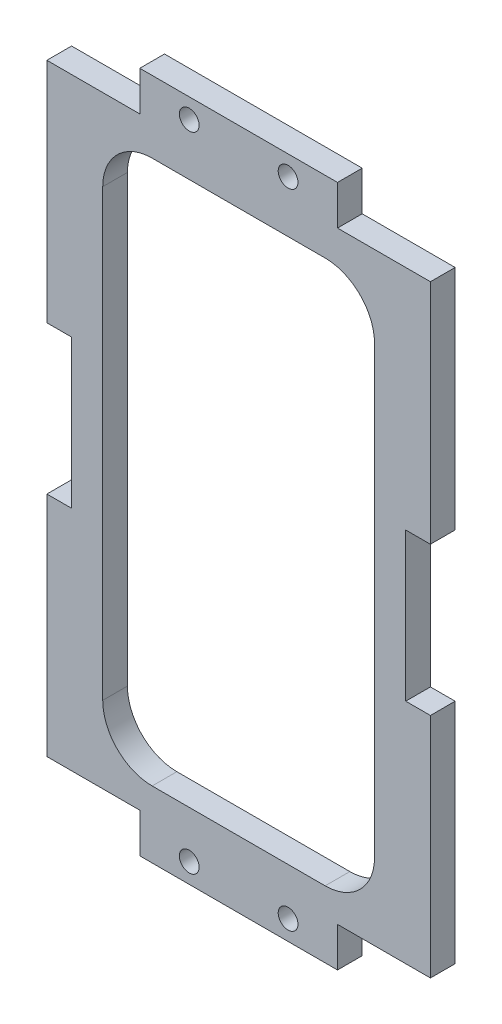
from build123d import *

# Parameters (mm, degrees)
SKETCH_1_W          = 77.6
SKETCH_1_H          = 137
EXTRUDE_1_DEPTH     = 5
SKETCH_3_W          = 18.8
SKETCH_3_H          = 7.5
SKETCH_3_W_2        = 5
SKETCH_3_H_2        = 30
CUT_EXTRUDE_1_DEPTH = 5
SKETCH_4_R          = 2
CUT_EXTRUDE_2_DEPTH = 5
SKETCH_5_W          = 55
SKETCH_5_H          = 110
CUT_EXTRUDE_3_DEPTH = 7
FILLET_1_R          = 10
SKETCH_7_W          = 40
SKETCH_7_H          = 0.5
EXTRUDE_2_DEPTH     = 5


with BuildPart() as part:
    # 草图1 → 凸台-拉伸1 (new body)
    with BuildSketch(Plane.XY):
        with Locations((38.8, 68.5)):
            Rectangle(SKETCH_1_W, SKETCH_1_H)
    extrude(amount=EXTRUDE_1_DEPTH)

    # 草图3 → 切除-拉伸1 (cut)
    with BuildSketch(Plane.XY.offset(5)):
        with Locations((9.4, 133.25)):
            Rectangle(SKETCH_3_W, SKETCH_3_H)
        with Locations((9.4, 3.75)):
            Rectangle(SKETCH_3_W, SKETCH_3_H)
        with Locations((68.2, 3.75)):
            Rectangle(SKETCH_3_W, SKETCH_3_H)
        with Locations((68.2, 133.25)):
            Rectangle(SKETCH_3_W, SKETCH_3_H)
        with Locations((75.1, 68.5)):
            Rectangle(SKETCH_3_W_2, SKETCH_3_H_2)
        with Locations((2.5, 68.5)):
            Rectangle(SKETCH_3_W_2, SKETCH_3_H_2)
    extrude(amount=-CUT_EXTRUDE_1_DEPTH, mode=Mode.SUBTRACT)

    # 草图4 → 切除-拉伸2 (cut)
    with BuildSketch(Plane.XY.offset(5)):
        with Locations((28.8, 133.5)):
            Circle(SKETCH_4_R)
        with Locations((48.8, 133.5)):
            Circle(SKETCH_4_R)
        with Locations((28.8, 3.5)):
            Circle(SKETCH_4_R)
        with Locations((48.8, 3.5)):
            Circle(SKETCH_4_R)
    extrude(amount=-CUT_EXTRUDE_2_DEPTH, mode=Mode.SUBTRACT)

    # 草图5 → 切除-拉伸3 (cut)
    with BuildSketch(Plane(origin=(0, 0, 0), x_dir=(-1, 0, 0), z_dir=(0, 0, -1))):
        with Locations((-38.8, 68)):
            Rectangle(SKETCH_5_W, SKETCH_5_H)
    extrude(amount=-CUT_EXTRUDE_3_DEPTH, mode=Mode.SUBTRACT)

    # 圆角1
    fillet_1_edges = [part.edges().sort_by_distance(p)[0] for p in [
        (66.3, 13, 2.5),
        (66.3, 123, 2.5),
        (11.3, 123, 2.5),
        (11.3, 13, 2.5),
    ]]
    fillet(fillet_1_edges, radius=FILLET_1_R)

    # 草图7 → 凸台-拉伸2 (add)
    with BuildSketch(Plane.XY.offset(5)):
        with Locations((38.8, 137.25)):
            Rectangle(SKETCH_7_W, SKETCH_7_H)
        with Locations((38.8, -0.25)):
            Rectangle(SKETCH_7_W, SKETCH_7_H)
    extrude(amount=-EXTRUDE_2_DEPTH)


solid = part.part
